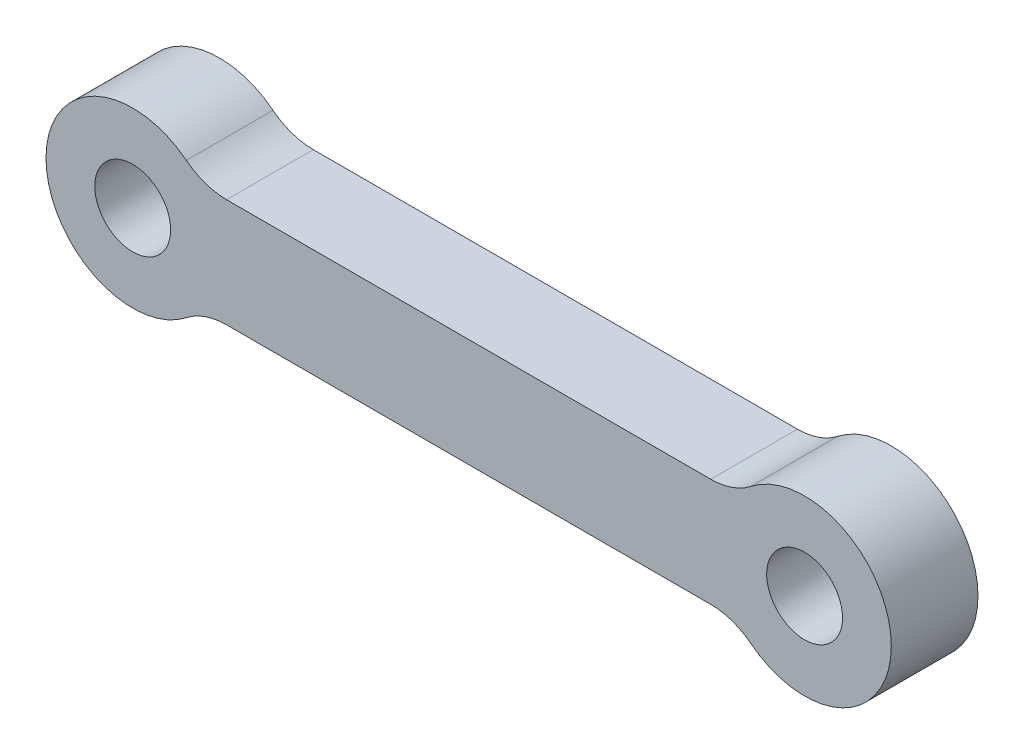
from build123d import *

# Parameters (mm, degrees)
SKETCH1_R           = 4
SKETCH1_R_2         = 1.75
BOSS_EXTRUDE1_DEPTH = 4
FILLET1_R           = 3


with BuildPart() as part:
    # Sketch1 → Boss-Extrude1 (new body)
    # profile 1 of 3: a face of its own
    with BuildSketch(Plane.XY):
        with Locations((-15.5, 0)):
            Circle(SKETCH1_R)
        with Locations((-15.5, 0)):
            Circle(SKETCH1_R_2, mode=Mode.SUBTRACT)
    # profile 2 of 3: a face of its own
    with BuildSketch(Plane.XY):
        with BuildLine():
            Line((12.377501001, 2.5), (-12.377501001, 2.5))
            ThreePointArc((-12.377501001, 2.5), (-11.725745372, 1.324764885), (-11.5, 0))
            ThreePointArc((-11.5, 0), (-11.725745372, -1.324764885), (-12.377501001, -2.5))
            Line((-12.377501001, -2.5), (12.377501001, -2.5))
            ThreePointArc((12.377501001, -2.5), (11.5, 0), (12.377501001, 2.5))
        make_face()
    # profile 3 of 3: a face of its own
    with BuildSketch(Plane.XY):
        with Locations((15.5, 0)):
            Circle(SKETCH1_R)
        with Locations((15.5, 0)):
            Circle(SKETCH1_R_2, mode=Mode.SUBTRACT)
    extrude(amount=BOSS_EXTRUDE1_DEPTH)

    # Fillet1
    fillet1_edges = [part.edges().sort_by_distance(p)[0] for p in [
        (-12.377501001, 2.5, 2),
        (12.377501001, 2.5, 2),
        (12.377501001, -2.5, 2),
        (-12.377501001, -2.5, 2),
    ]]
    fillet(fillet1_edges, radius=FILLET1_R)


solid = part.part
